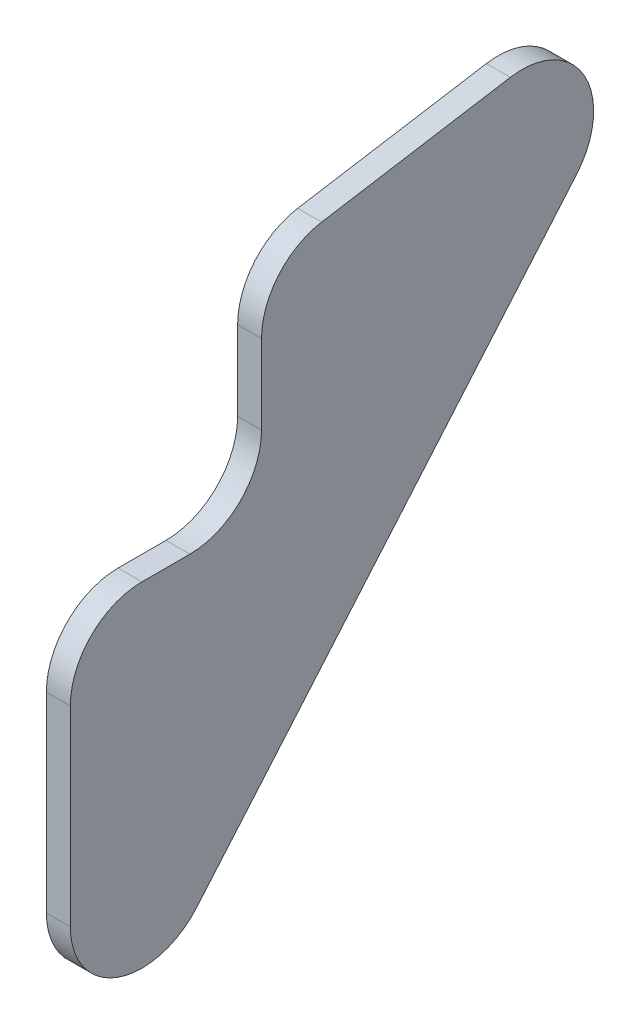
from build123d import *

# Parameters (mm, degrees)
BOSS_EXTRUDE1_START = 66.421062
BOSS_EXTRUDE1_DEPTH = 3.175
FILLET1_R           = 9.525


with BuildPart() as part:
    # Sketch1 → Boss-Extrude1 (new body)
    with BuildSketch(Plane(origin=(0, 0, 0), x_dir=(0, 0, -1), z_dir=(1, 0, 0)).offset(BOSS_EXTRUDE1_START)):
        with BuildLine():
            Line((-1321.232047874, 253.01907305), (-1270.768280058, 312.11266745))
            ThreePointArc((-1270.768280058, 312.11266745), (-1269.714759772, 322.976697122), (-1279.556254241, 327.697081886))
            Line((-1279.556254241, 327.697081886), (-1304.620022056, 323.577914146))
            ThreePointArc((-1304.620022056, 323.577914146), (-1310.336145998, 320.343921033), (-1312.600334154, 314.179001215))
            Line((-1312.600334154, 314.179001215), (-1312.600334154, 294.129574554))
            Line((-1312.600334154, 294.129574554), (-1328.475334154, 294.129574554))
            ThreePointArc((-1328.475334154, 294.129574554), (-1335.210526245, 291.339766645), (-1338.000334154, 284.604574554))
            Line((-1338.000334154, 284.604574554), (-1338.000334154, 259.204574554))
            ThreePointArc((-1338.000334154, 259.204574554), (-1331.771796135, 250.268190307), (-1321.232047874, 253.01907305))
        make_face()
    extrude(amount=BOSS_EXTRUDE1_DEPTH)

    # Fillet1
    fillet1_edges = [part.edges().sort_by_distance(p)[0] for p in [
        (68.008562, 294.129574554, 1312.600334154),
    ]]
    fillet(fillet1_edges, radius=FILLET1_R)


solid = part.part
